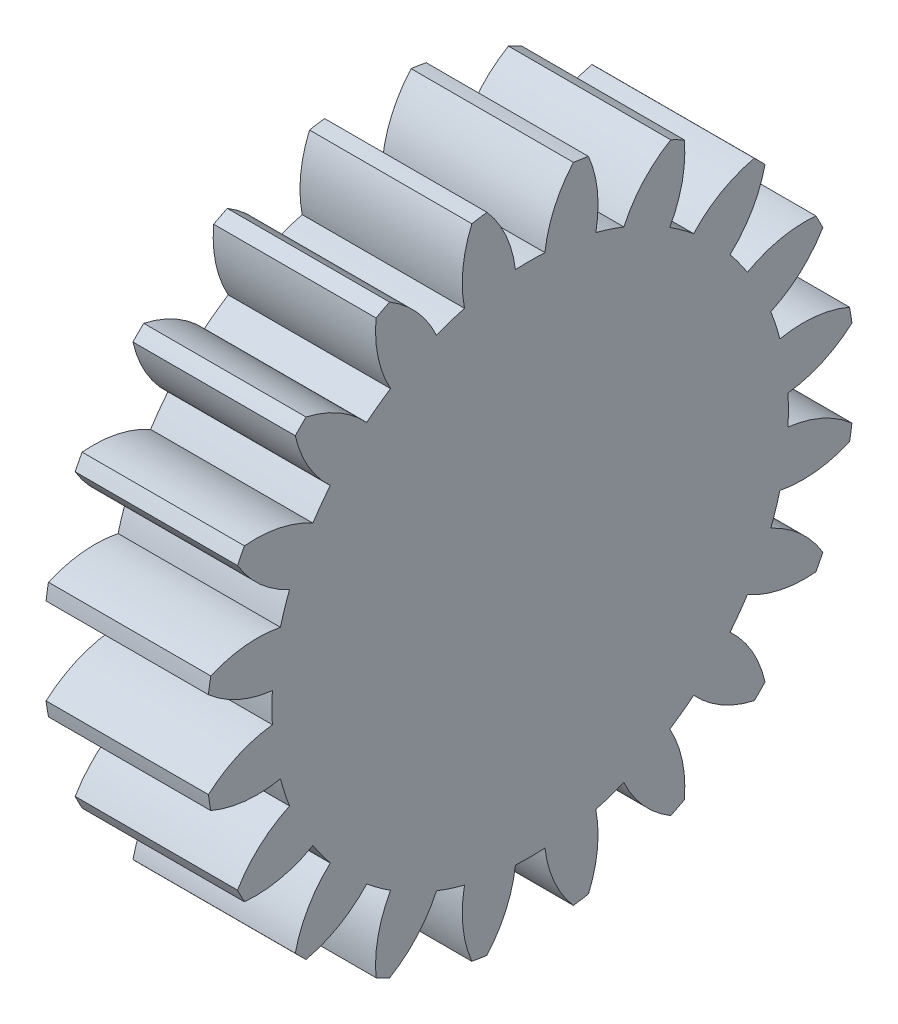
from build123d import *

# Parameters (mm, degrees)
BASPROSKE_W     = 5.5
BASPROSKE_H     = 11
TOOTHCUT_DEPTH  = 17.5
TEETHCUTS_COUNT = 20
TEETHCUTS_ANGLE = 342
BORSKE_R        = 3
BORE_DEPTH      = 50.0000508
EXTRUDE_START   = -5.5
SKETCH_1_R      = 3
EXTRUDE_1_DEPTH = 5.5


with BuildPart() as part:
    # BasProSke → Base-Revolve (revolve)
    with BuildSketch(Plane(origin=(0, 0, 0), x_dir=(1, 0, 0), z_dir=(0, 1, 0)), mode=Mode.PRIVATE) as base_revolve_sk:
        with Locations((2.75, 5.5)):
            Rectangle(BASPROSKE_W, BASPROSKE_H)
    revolve(base_revolve_sk.sketch.rotate(Axis((-10, 0, 0), (1, 0, 0)), 180), axis=Axis((-10, 0, 0), (1, 0, 0)))

    # TooCutSke → ToothCut (cut, through all)
    with BuildSketch(Plane(origin=(0, 0, 0), x_dir=(0, 0, -1), z_dir=(1, 0, 0))):
        with BuildLine():
            ThreePointArc((0.499924007, 8.734705318), (0, 8.749), (-0.499924007, 8.734705318))
            ThreePointArc((-0.499924007, 8.734705318), (-0.824302243, 9.905497836), (-1.485192705, 10.924909509))
            ThreePointArc((-1.485192705, 10.924909509), (0, 11.0254), (1.485192705, 10.924909509))
            ThreePointArc((1.485192705, 10.924909509), (0.824302243, 9.905497836), (0.499924007, 8.734705318))
        make_face()
    toothcut = extrude(amount=TOOTHCUT_DEPTH, mode=Mode.SUBTRACT)

    # TeethCuts: ToothCut ×20 about axis
    teethcuts_axis = Axis((-10, 0, 0), (1, 0, 0))
    for i in range(1, TEETHCUTS_COUNT):
        add(toothcut.rotate(teethcuts_axis, i * TEETHCUTS_ANGLE / (TEETHCUTS_COUNT - 1)), mode=Mode.SUBTRACT)

    # BorSke → Bore (cut, symmetric)
    with BuildSketch(Plane(origin=(0, 0, 0), x_dir=(0, 0, -1), z_dir=(1, 0, 0))):
        with Locations(Location((0, 0, 0), (0, 0, 180))):
            Circle(BORSKE_R)
    extrude(amount=BORE_DEPTH, both=True, mode=Mode.SUBTRACT)

    # ｽｹｯﾁ1 → ﾎﾞｽ - 押し出し1 (add)
    with BuildSketch(Plane.ZY.offset(EXTRUDE_START)):
        Circle(SKETCH_1_R)
    extrude(amount=EXTRUDE_1_DEPTH)


solid = part.part
